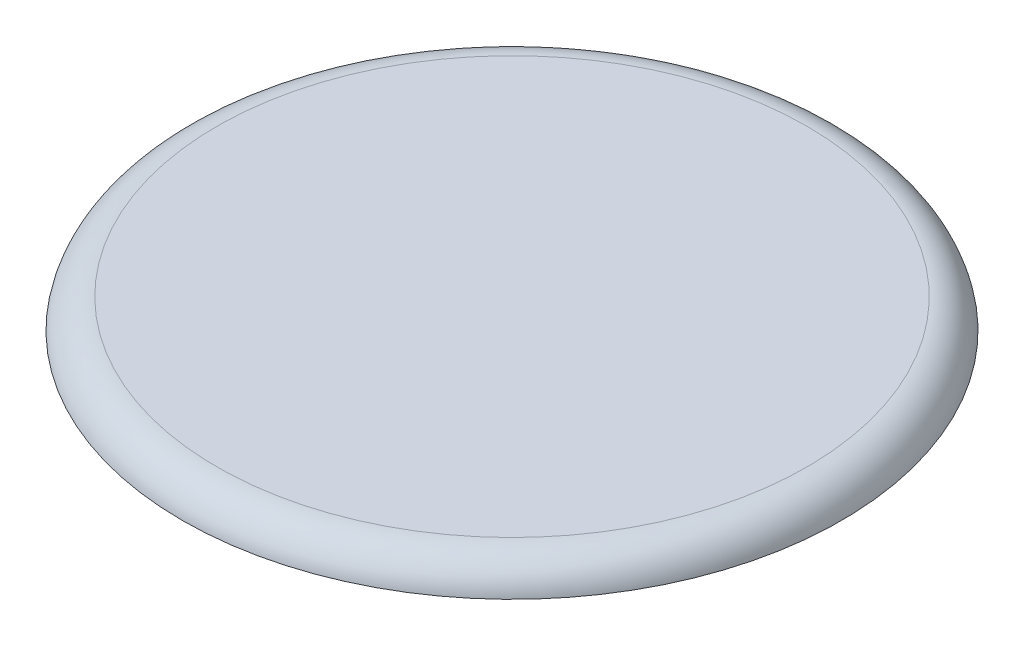
from build123d import *

# Parameters (mm, degrees)
SKETCH2_R          = 1.785
CUT_EXTRUDE1_DEPTH = 1.5


with BuildPart() as part:
    # Sketch1 → Revolve1 (revolve)
    with BuildSketch(Plane.XY, mode=Mode.PRIVATE) as revolve1_sk:
        with BuildLine():
            Line((50.583920217, 5), (0, 5))
            Line((0, 5), (0, 1.5))
            Line((0, 1.5), (47, 1.5))
            Line((47, 1.5), (47, 0))
            Line((47, 0), (56.5, 0))
            ThreePointArc((56.5, 0), (54.456903563, 3.582575695), (50.583920217, 5))
        make_face()
    revolve(revolve1_sk.sketch.rotate(Axis((0, 0, 0), (0, 1, 0)), 90), axis=Axis((0, 0, 0), (0, 1, 0)))

    # Sketch2 → Cut-Extrude1 (cut)
    with BuildSketch(Plane.XZ):
        with Locations(Location((0, 51.91, 0), (0, 0, 270))):
            Circle(SKETCH2_R)
        with Locations(Location((51.91, 0, 0), (0, 0, 270))):
            Circle(SKETCH2_R)
        with Locations(Location((0, -51.91, 0), (0, 0, 270))):
            Circle(SKETCH2_R)
        with Locations(Location((-51.91, 0, 0), (0, 0, 270))):
            Circle(SKETCH2_R)
    extrude(amount=-CUT_EXTRUDE1_DEPTH, mode=Mode.SUBTRACT)


solid = part.part
